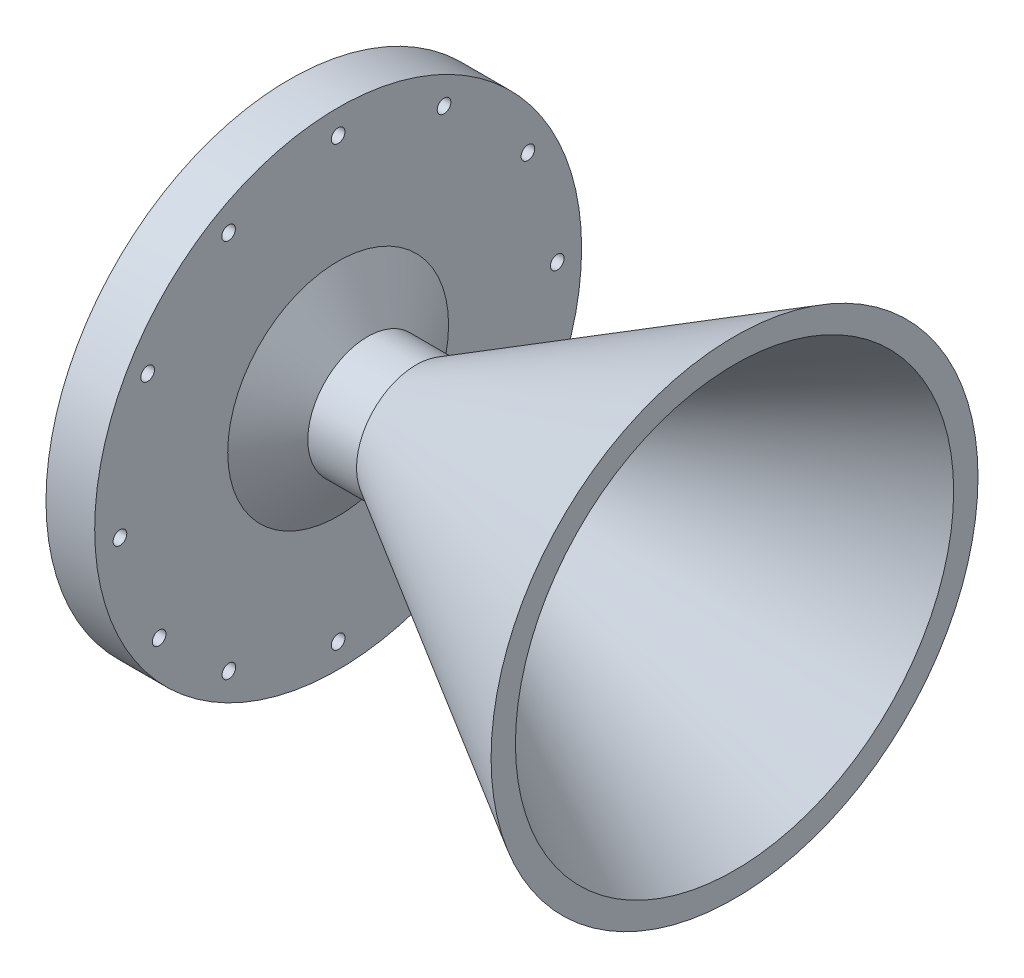
from build123d import *

# Parameters (mm, degrees)
SKETCH3_R          = 1.778
CUT_EXTRUDE1_DEPTH = 12.7


with BuildPart() as part:
    # Sketch1 → Revolve1 (revolve)
    with BuildSketch(Plane.XY, mode=Mode.PRIVATE) as revolve1_sk:
        Polygon((0, 15.5575), (83.038845842, 63.5), (83.038845842, 57.15), (0, 7.9375), (-12.7, 7.9375), (-33.047266862, 44.45), (-33.047266862, 50.8), (-33.047266862, 63.5), (-20.347266862, 63.5), (-20.347266862, 28.802954744), (-12.7, 15.5575), align=None)
    revolve(revolve1_sk.sketch.rotate(Axis((0, 0, 0), (1, 0, 0)), 90), axis=Axis((0, 0, 0), (1, 0, 0)))

    # Sketch3 → Cut-Extrude1 (cut)
    with BuildSketch(Plane.ZY.offset(33.047266862)):
        with Locations((56.912428742, -5.205569588)):
            Circle(SKETCH3_R)
        with Locations((0, 57.15)):
            Circle(SKETCH3_R)
        with Locations((-57.15, 0)):
            Circle(SKETCH3_R)
        with Locations((-27.61584041, 50.034866428)):
            Circle(SKETCH3_R)
        with Locations((-49.493351826, 28.575)):
            Circle(SKETCH3_R)
        with Locations((28.575, 49.493351826)):
            Circle(SKETCH3_R)
        with Locations((49.682843524, 28.244248253)):
            Circle(SKETCH3_R)
        with Locations((-30.522003084, -48.31697246)):
            Circle(SKETCH3_R)
        with Locations((-50.034866428, -27.61584041)):
            Circle(SKETCH3_R)
        with Locations((46.684824287, -32.964369875)):
            Circle(SKETCH3_R)
        with Locations((28.49967153, -49.536766373)):
            Circle(SKETCH3_R)
        with Locations((0, -57.15)):
            Circle(SKETCH3_R)
    extrude(amount=-CUT_EXTRUDE1_DEPTH, mode=Mode.SUBTRACT)


solid = part.part
